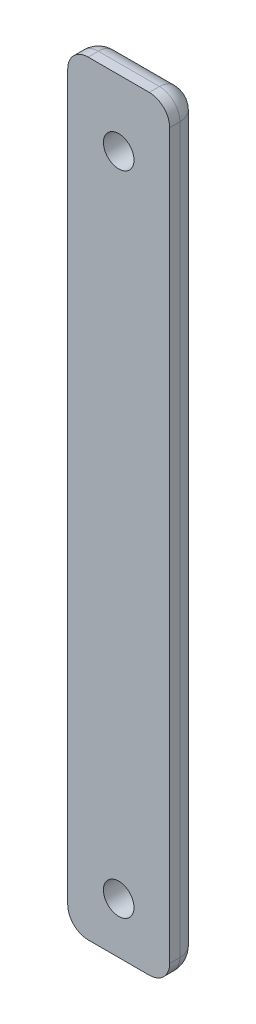
from build123d import *

# Parameters (mm, degrees)
SKETCH_1_W          = 10
SKETCH_1_H          = 75
EXTRUDE_1_DEPTH     = 1.5
FILLET_1_R          = 2
SKETCH_3_R          = 1.5
CUT_EXTRUDE_1_DEPTH = 10


with BuildPart() as part:
    # 草图1 → 凸台-拉伸1 (new, symmetric)
    with BuildSketch(Plane.XY):
        Rectangle(SKETCH_1_W, SKETCH_1_H)
    extrude(amount=EXTRUDE_1_DEPTH, both=True)

    # 圆角1
    fillet_1_edges = [part.edges().sort_by_distance(p)[0] for p in [
        (0, -37.5, -1.5),
        (-5, 0, -1.5),
        (0, 37.5, -1.5),
        (5, 0, -1.5),
        (5, -37.5, 0),
        (-5, -37.5, 0),
        (-5, 37.5, 0),
        (5, 37.5, 0),
    ]]
    fillet(fillet_1_edges, radius=FILLET_1_R)

    # 草图3 → 切除-拉伸1 (cut)
    with BuildSketch(Plane.XY.offset(1.5)):
        with Locations((0, 31)):
            Circle(SKETCH_3_R)
        with Locations((0, -32.5)):
            Circle(SKETCH_3_R)
    extrude(amount=-CUT_EXTRUDE_1_DEPTH, mode=Mode.SUBTRACT)


solid = part.part
